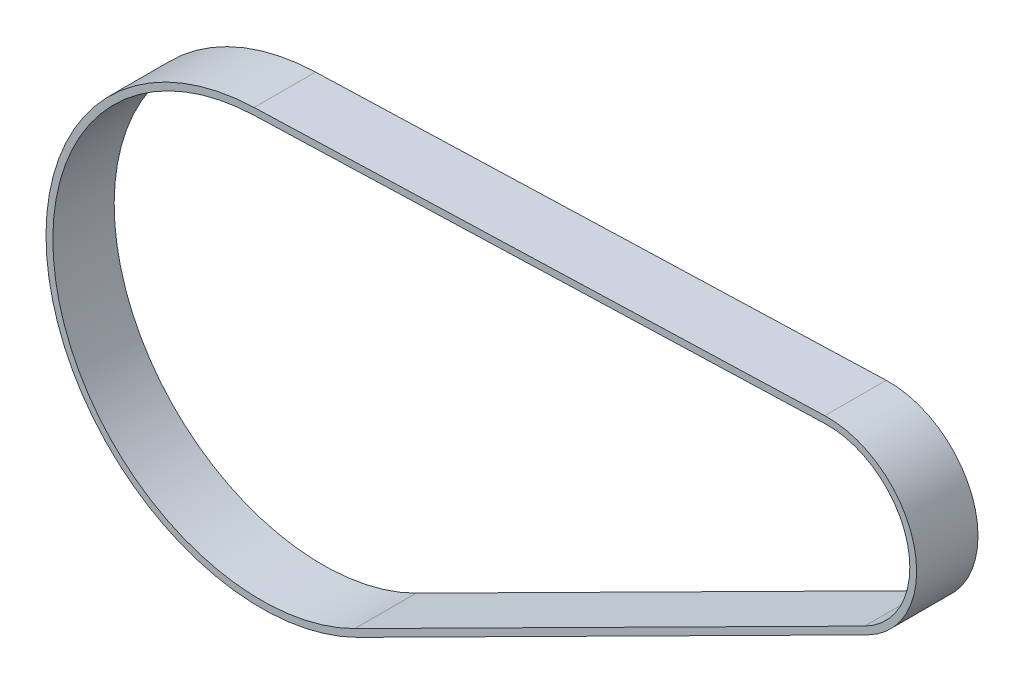
from build123d import *

# Parameters (mm, degrees)
EXTRUDE_THIN1_DEPTH      = 4.5
EXTRUDE_THIN1_DEPTH_BACK = 4.5


with BuildPart() as part:
    # Sketch2 → Extrude-Thin1 (new, two sides: drawn at the far end of the back side and taken through both)
    with BuildSketch(Plane.XY.offset(-EXTRUDE_THIN1_DEPTH_BACK)):
        with BuildLine():
            Line((88.991128511, 9.539864846), (14.205358539, -28.171089592))
            ThreePointArc((14.205358539, -28.171089592), (-30.571882386, -7.795030941), (-1.017771578, 31.533579578))
            Line((-1.017771578, 31.533579578), (82.694397988, 34.235457007))
            ThreePointArc((82.694397988, 34.235457007), (95.760800024, 24.416501073), (88.991128511, 9.539864846))
        make_face()
        with BuildLine():
            Line((88.540879429, 10.432767844), (13.755109457, -27.278186594))
            ThreePointArc((13.755109457, -27.278186594), (-29.602884529, -7.547961814), (-0.985512574, 30.534100035))
            Line((-0.985512574, 30.534100035), (82.726656992, 33.235977464))
            ThreePointArc((82.726656992, 33.235977464), (94.791802167, 24.169431946), (88.540879429, 10.432767844))
        make_face(mode=Mode.SUBTRACT)
    extrude(amount=EXTRUDE_THIN1_DEPTH + EXTRUDE_THIN1_DEPTH_BACK)


solid = part.part
